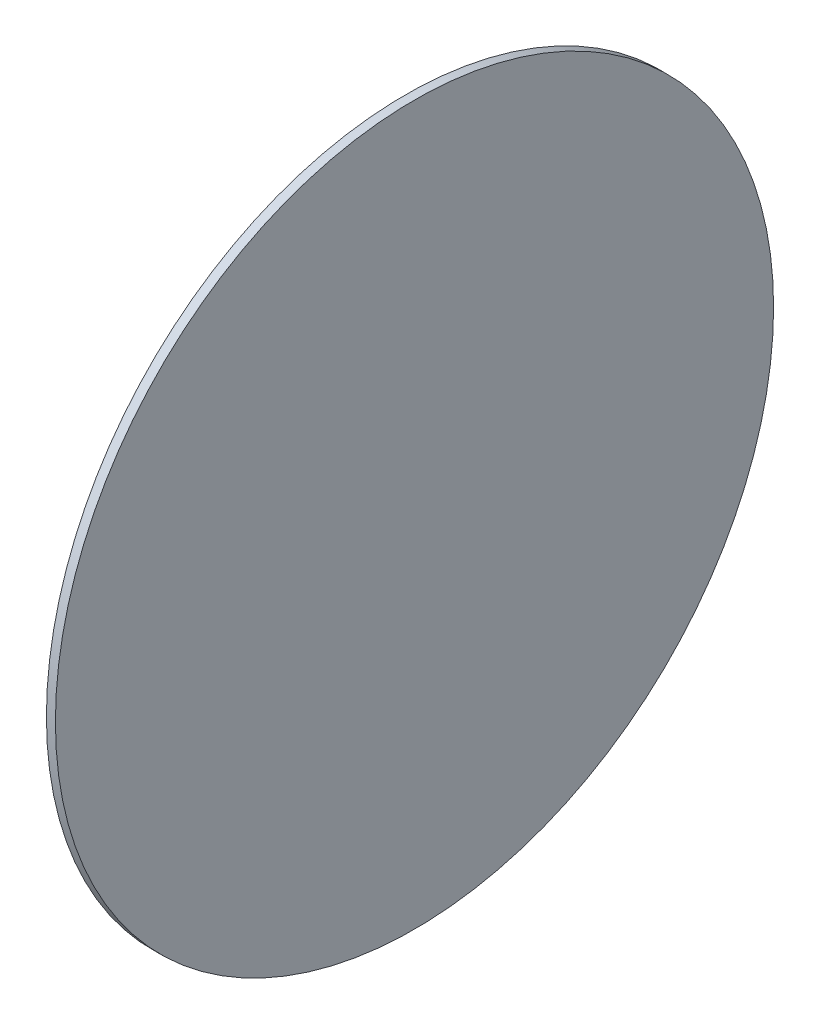
from build123d import *

# Parameters (mm, degrees)
CROQUIS1_R              = 99.83
SALIENTE_EXTRUIR6_DEPTH = 2.5


with BuildPart() as part:
    # Croquis1 → Saliente-Extruir6 (new body)
    with BuildSketch(Plane(origin=(0, 0, 0), x_dir=(0, 0, -1), z_dir=(1, 0, 0))):
        Circle(CROQUIS1_R)
    extrude(amount=SALIENTE_EXTRUIR6_DEPTH)


solid = part.part
